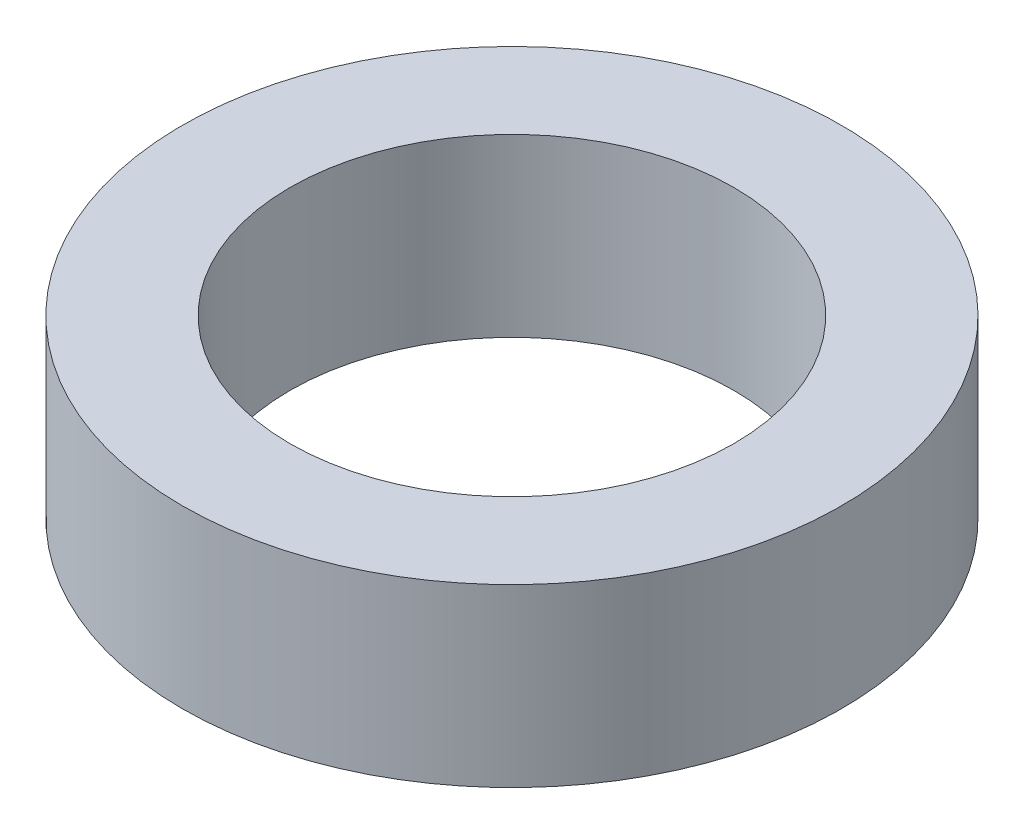
from build123d import *

# Parameters (mm, degrees)
SKETCH1_R                         = 15
SKETCH1_R_2                       = 10.1
REVOLVED_EQUIVALENT_EXTRUDE_DEPTH = 8


with BuildPart() as part:
    # Sketch1 → Revolved_Equivalent_Extrude (new body)
    with BuildSketch(Plane(origin=(0, 0, 0), x_dir=(1, 0, 0), z_dir=(0, 1, 0))):
        with Locations(Location((0, 0, 0), (0, 0, 270))):
            Circle(SKETCH1_R)
        with Locations(Location((0, 0, 0), (0, 0, 270))):
            Circle(SKETCH1_R_2, mode=Mode.SUBTRACT)
    extrude(amount=REVOLVED_EQUIVALENT_EXTRUDE_DEPTH)


solid = part.part
